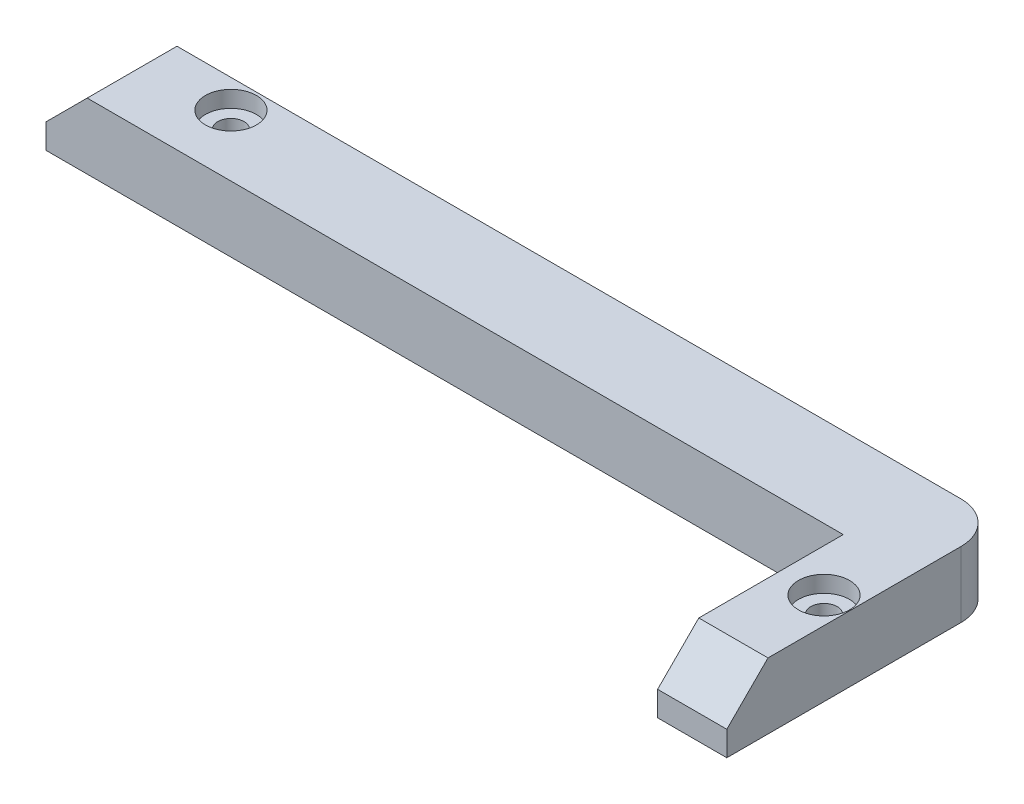
from build123d import *

# Parameters (mm, degrees)
SKETCH_1_W              = 337.35
SKETCH_1_H              = 116.87
SKETCH_1_W_2            = 324.05
SKETCH_1_H_2            = 103.07
EXTRUDE_1_DEPTH         = 8
FILLET_1_R              = 5
HOLE_WIZARD_3_2_3_2_1_D = 3.2
SKETCH_5_W              = 32
SKETCH_5_H              = 1.5
CUT_EXTRUDE_1_DEPTH     = 355.911853
EXTRUDE_2_REACH         = 356.912
SKETCH_6_W              = 3
SKETCH_6_H              = 8
SKETCH_7_W              = 257.05
SKETCH_7_H              = 8
EXTRUDE_3_DEPTH         = 4
SKETCH_8_W              = 257.05
SKETCH_8_H              = 4
EXTRUDE_4_DEPTH         = 3
SKETCH_11_W             = 99.07
SKETCH_11_H             = 11
EXTRUDE_5_DEPTH         = 2
SKETCH_13_W             = 42
SKETCH_13_H             = 4.5
CUT_EXTRUDE_2_DEPTH     = 354.692894189
SKETCH_14_W             = 121.5
SKETCH_14_H             = 1.5
CUT_EXTRUDE_3_DEPTH     = 355.911853
SKETCH_16_W             = 32
SKETCH_16_H             = 6.5
EXTRUDE_7_DEPTH         = 4
SKETCH_17_W             = 103.07
SKETCH_17_H             = 3
CUT_EXTRUDE_4_DEPTH     = 0.1
EXTRUDE_8_DEPTH         = 2
SKETCH_19_W             = 70.55
SKETCH_19_H             = 2
SKETCH_19_W_2           = 95
EXTRUDE_9_DEPTH         = 3
SKETCH_20_R             = 3.5
CUT_EXTRUDE_5_DEPTH     = 4
SKETCH_21_R             = 3.1
CUT_EXTRUDE_6_DEPTH     = 2
EXTRUDE_10_DEPTH        = 2
EXTRUDE_10_DEPTH_BACK   = 3
SKETCH_22_W             = 6
SKETCH_22_H             = 6
SKETCH_22_R             = 1.5
SKETCH_23_W             = 10
SKETCH_23_H             = 1.5
SKETCH_23_W_2           = 15
CUT_EXTRUDE_7_DEPTH     = 6.9
SKETCH_24_W             = 103.07
SKETCH_24_H             = 3
CUT_EXTRUDE_8_DEPTH     = 358.110094229
SKETCH_25_W             = 466.496248886
SKETCH_25_H             = 203.631856069
SKETCH_25_W_2           = 113.515173444
SKETCH_25_H_2           = 34.550681359
CUT_EXTRUDE_9_DEPTH     = 358.110094229
CHAMFER_1_SIZE          = 5
SKETCH_26_W             = 42
SKETCH_26_H             = 10.9
EXTRUDE_11_DEPTH        = 1.5


with BuildPart() as part:
    # 草图1 → 凸台-拉伸1 (new body)
    with BuildSketch(Plane(origin=(0, 0, 0), x_dir=(1, 0, 0), z_dir=(0, 1, 0))):
        with Locations((168.675, 58.435)):
            Rectangle(SKETCH_1_W, SKETCH_1_H)
        with Locations((168.925, 58.435)):
            Rectangle(SKETCH_1_W_2, SKETCH_1_H_2, mode=Mode.SUBTRACT)
    extrude(amount=EXTRUDE_1_DEPTH)

    # 圆角1
    fillet_1_edges = [part.edges().sort_by_distance(p)[0] for p in [
        (0, 4, -116.87),
        (337.35, 4, -116.87),
        (337.35, 4, 0),
        (0, 4, 0),
    ]]
    fillet(fillet_1_edges, radius=FILLET_1_R)

    # Ø3.2 (3.2) 直径孔1 (through all)
    with Locations(Plane(origin=(0, 8, 0), x_dir=(1, 0, 0), z_dir=(0, 1, 0))):
        with Locations((3.45, 98.435), (87.17, 113.42), (247.17, 113.42), (334.15, 98.435), (334.15, 18.435), (247.17, 3.45), (87.17, 3.45), (3.45, 18.435)):
            Hole(HOLE_WIZARD_3_2_3_2_1_D / 2)

    # 草图5 → 切除-拉伸1 (cut, through all)
    with BuildSketch(Plane.XY.offset(-109.97)):
        with Locations((57.9, 0.75)):
            Rectangle(SKETCH_5_W, SKETCH_5_H)
    extrude(amount=-CUT_EXTRUDE_1_DEPTH, mode=Mode.SUBTRACT)

    # 草图6 → 凸台-拉伸2 (add, up to next)
    with BuildSketch(Plane.XY.offset(-109.97), mode=Mode.PRIVATE) as extrude_2_sk1:
        with Locations((40.4, 4)):
            Rectangle(SKETCH_6_W, SKETCH_6_H)
    extrude_2_tool1 = extrude(extrude_2_sk1.sketch, amount=EXTRUDE_2_REACH, mode=Mode.PRIVATE) - part.part
    add(extrude_2_tool1.solids().sort_by_distance((40.4, 4, -109.97))[0])

    # 草图7 → 凸台-拉伸3 (add)
    with BuildSketch(Plane.XY.offset(-109.97)):
        with Locations((202.425, 4)):
            Rectangle(SKETCH_7_W, SKETCH_7_H)
    extrude(amount=EXTRUDE_3_DEPTH)

    # 草图8 → 凸台-拉伸4 (add)
    with BuildSketch(Plane.XZ):
        with Locations((202.425, -107.97)):
            Rectangle(SKETCH_8_W, SKETCH_8_H)
    extrude(amount=EXTRUDE_4_DEPTH)

    # 草图11 → 凸台-拉伸5 (add)
    with BuildSketch(Plane.ZY.offset(-330.95)):
        with Locations((-56.435, 2.5)):
            Rectangle(SKETCH_11_W, SKETCH_11_H)
    extrude(amount=EXTRUDE_5_DEPTH)

    # 草图13 → 切除-拉伸2 (cut, through all)
    with BuildSketch(Plane.XY.offset(-105.97)):
        with Locations((307.95, -0.75)):
            Rectangle(SKETCH_13_W, SKETCH_13_H)
    extrude(amount=-CUT_EXTRUDE_2_DEPTH, mode=Mode.SUBTRACT)

    # 草图14 → 切除-拉伸3 (cut, through all)
    with BuildSketch(Plane(origin=(0, 0, -6.9), x_dir=(-1, 0, 0), z_dir=(0, 0, -1))):
        with Locations((-173.2, 0.75)):
            Rectangle(SKETCH_14_W, SKETCH_14_H)
    extrude(amount=-CUT_EXTRUDE_3_DEPTH, mode=Mode.SUBTRACT)

    # 草图16 → 凸台-拉伸7 (add)
    with BuildSketch(Plane.XY.offset(-109.97)):
        with Locations((57.9, 4.75)):
            Rectangle(SKETCH_16_W, SKETCH_16_H)
    extrude(amount=EXTRUDE_7_DEPTH)

    # 草图17 → 切除-拉伸4 (cut)
    with BuildSketch(Plane(origin=(330.95, 0, 0), x_dir=(0, 0, -1), z_dir=(1, 0, 0))):
        with Locations((58.435, -1.5)):
            Rectangle(SKETCH_17_W, SKETCH_17_H)
    extrude(amount=-CUT_EXTRUDE_4_DEPTH, mode=Mode.SUBTRACT)

    # 草图18 → 凸台-拉伸8 (add)
    with BuildSketch(Plane(origin=(0, 0, -6.9), x_dir=(-1, 0, 0), z_dir=(0, 0, -1))):
        Polygon((-233.95, 0), (-233.95, 1.5), (-112.45, 1.5), (-112.45, 0), (-41.9, 0), (-41.9, 8), (-328.95, 8), (-328.95, 0), align=None)
    extrude(amount=EXTRUDE_8_DEPTH)

    # 草图19 → 凸台-拉伸9 (add)
    with BuildSketch(Plane.XZ):
        with Locations((77.175, -7.9)):
            Rectangle(SKETCH_19_W, SKETCH_19_H)
        with Locations((281.45, -7.9)):
            Rectangle(SKETCH_19_W_2, SKETCH_19_H)
    extrude(amount=EXTRUDE_9_DEPTH)

    # 草图20 → 切除-拉伸5 (cut)
    with BuildSketch(Plane.XZ.offset(3)):
        with Locations((92.088456012, -9.54)):
            Circle(SKETCH_20_R)
        with Locations((262.268456012, -9.54)):
            Circle(SKETCH_20_R)
        with Locations((328.308456012, -13.35)):
            Circle(SKETCH_20_R)
        with Locations((328.308456012, -74.31)):
            Circle(SKETCH_20_R)
        with Locations((137.808456012, -107.33)):
            Circle(SKETCH_20_R)
        with Locations((22.238456012, -9.54)):
            Circle(SKETCH_20_R)
        with Locations((9.538456012, -23.51)):
            Circle(SKETCH_20_R)
        with Locations((9.538456012, -103.52)):
            Circle(SKETCH_20_R)
    extrude(amount=-CUT_EXTRUDE_5_DEPTH, mode=Mode.SUBTRACT)

    # 草图21 → 切除-拉伸6 (cut)
    with BuildSketch(Plane(origin=(0, 8, 0), x_dir=(1, 0, 0), z_dir=(0, 1, 0))):
        with Locations(Location((87.17, 113.42, 0), (0, 0, 270))):
            Circle(SKETCH_21_R)
        with Locations(Location((247.17, 113.42, 0), (0, 0, 270))):
            Circle(SKETCH_21_R)
        with Locations(Location((334.15, 98.435, 0), (0, 0, 270))):
            Circle(SKETCH_21_R)
        with Locations(Location((334.15, 18.435, 0), (0, 0, 270))):
            Circle(SKETCH_21_R)
        with Locations(Location((247.17, 3.45, 0), (0, 0, 270))):
            Circle(SKETCH_21_R)
        with Locations(Location((87.17, 3.45, 0), (0, 0, 270))):
            Circle(SKETCH_21_R)
        with Locations(Location((3.45, 18.435, 0), (0, 0, 270))):
            Circle(SKETCH_21_R)
        with Locations(Location((3.45, 98.435, 0), (0, 0, 270))):
            Circle(SKETCH_21_R)
    extrude(amount=-CUT_EXTRUDE_6_DEPTH, mode=Mode.SUBTRACT)

    # 草图22 → 凸台-拉伸10 (add, two sides: drawn at the far end of the back side and taken through both)
    # profile 1 of 4: a face of its own
    with BuildSketch(Plane(origin=(0, 4, 0), x_dir=(1, 0, 0), z_dir=(0, 1, 0)).offset(-EXTRUDE_10_DEPTH_BACK)):
        with Locations((9.9, 106.97)):
            Rectangle(SKETCH_22_W, SKETCH_22_H)
        with Locations(Location((9.9, 106.97, 0), (0, 0, 90))):
            Circle(SKETCH_22_R, mode=Mode.SUBTRACT)
    # profile 2 of 4: a face of its own
    with BuildSketch(Plane(origin=(0, 4, 0), x_dir=(1, 0, 0), z_dir=(0, 1, 0)).offset(-EXTRUDE_10_DEPTH_BACK)):
        with Locations((35.9, 106.97)):
            Rectangle(SKETCH_22_W, SKETCH_22_H)
        with Locations(Location((35.9, 106.97, 0), (0, 0, 90))):
            Circle(SKETCH_22_R, mode=Mode.SUBTRACT)
    # profile 3 of 4: a face of its own
    with BuildSketch(Plane(origin=(0, 4, 0), x_dir=(1, 0, 0), z_dir=(0, 1, 0)).offset(-EXTRUDE_10_DEPTH_BACK)):
        with Locations((9.9, 9.9)):
            Rectangle(SKETCH_22_W, SKETCH_22_H)
        with Locations(Location((9.9, 9.9, 0), (0, 0, 90))):
            Circle(SKETCH_22_R, mode=Mode.SUBTRACT)
    # profile 4 of 4: a face of its own
    with BuildSketch(Plane(origin=(0, 4, 0), x_dir=(1, 0, 0), z_dir=(0, 1, 0)).offset(-EXTRUDE_10_DEPTH_BACK)):
        with Locations((35.9, 9.9)):
            Rectangle(SKETCH_22_W, SKETCH_22_H)
        with Locations(Location((35.9, 9.9, 0), (0, 0, 90))):
            Circle(SKETCH_22_R, mode=Mode.SUBTRACT)
    extrude(amount=EXTRUDE_10_DEPTH + EXTRUDE_10_DEPTH_BACK)

    # 草图23 → 切除-拉伸7 (cut)
    with BuildSketch(Plane.ZY):
        with Locations((-63.435, 0.75)):
            Rectangle(SKETCH_23_W, SKETCH_23_H)
        with Locations((-50.935, 0.75)):
            Rectangle(SKETCH_23_W_2, SKETCH_23_H)
    extrude(amount=-CUT_EXTRUDE_7_DEPTH, mode=Mode.SUBTRACT)

    # 草图24 → 切除-拉伸8 (cut, through all)
    with BuildSketch(Plane(origin=(337.35, 0, 0), x_dir=(0, 0, -1), z_dir=(1, 0, 0))):
        with Locations((58.435, -1.5)):
            Rectangle(SKETCH_24_W, SKETCH_24_H)
    extrude(amount=-CUT_EXTRUDE_8_DEPTH, mode=Mode.SUBTRACT)

    # 草图25 → 切除-拉伸9 (cut, through all)
    with BuildSketch(Plane(origin=(0, 8, 0), x_dir=(1, 0, 0), z_dir=(0, 1, 0))):
        with Locations((204.544170856, 58.459603301)):
            Rectangle(SKETCH_25_W, SKETCH_25_H)
        with Locations((288.927586722, 100.71034068)):
            Rectangle(SKETCH_25_W_2, SKETCH_25_H_2, mode=Mode.SUBTRACT)
    extrude(amount=-CUT_EXTRUDE_9_DEPTH, mode=Mode.SUBTRACT)

    # 倒角1
    chamfer_1_edges = [part.edges().sort_by_distance(p)[0] for p in [
        (333.15, 8, -83.435),
        (232.17, 8, -111.42),
    ]]
    chamfer(chamfer_1_edges, length=CHAMFER_1_SIZE)

    # 草图26 → 凸台-拉伸11 (add)
    with BuildSketch(Plane.XZ.offset(-1.5)):
        with Locations((307.95, -111.42)):
            Rectangle(SKETCH_26_W, SKETCH_26_H)
    extrude(amount=EXTRUDE_11_DEPTH)


solid = part.part
